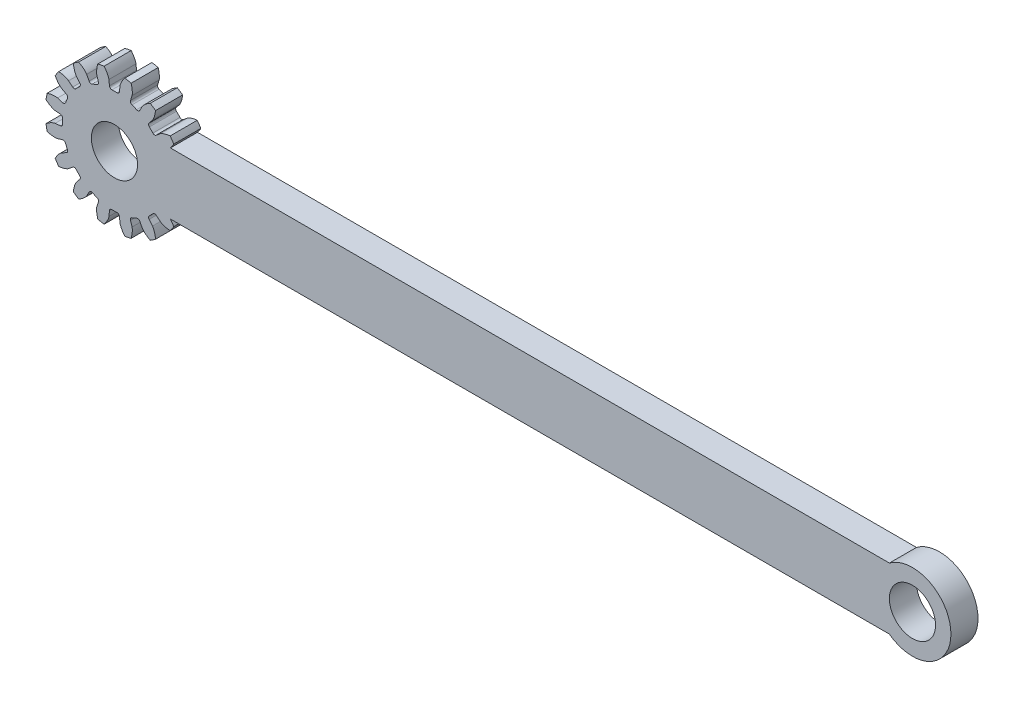
from build123d import *

# Parameters (mm, degrees)
BOSS_EXTRUDE1_DEPTH      = 5.588
CUT_EXTRUDE1_DEPTH       = 174.299858936
FILLET1_R                = 0.496244564
CIRPATTERN1_COUNT        = 16
FILLET1_OF_CIRPATTERN1_R = 0.496244564
SKETCH4_W                = 5.588
SKETCH4_H                = 12.7
BOSS_EXTRUDE2_DEPTH      = 5.08
SKETCH5_R                = 4.7625
CUT_EXTRUDE2_DEPTH       = 174.286693569


with BuildPart() as part:
    # Sketch1 → Boss-Extrude1 (new body)
    with BuildSketch(Plane.XY):
        with BuildLine():
            Line((12.798834175, -6.35), (159.919473719, -6.35))
            ThreePointArc((159.919473719, -6.35), (172.619473719, 0), (159.919473719, 6.35))
            Line((159.919473719, 6.35), (12.798834175, 6.35))
            ThreePointArc((12.798834175, 6.35), (-14.2875, 0), (12.798834175, -6.35))
        make_face()
    extrude(amount=BOSS_EXTRUDE1_DEPTH)

    # Sketch3 → Cut-Extrude1 (cut, through all)
    with BuildSketch(Plane.XY.offset(5.588)):
        with BuildLine():
            Line((10.669686204, 0.991168726), (12.242763286, 1.137300935))
            add(Edge.make_bspline(
                [(12.242763286, 1.137300935), (12.245929967, 1.137635145), (12.254799044, 1.138695353), (12.271514653, 1.141184629), (12.29870614, 1.145934011), (12.333220151, 1.152994888), (12.377662137, 1.163277963), (12.429783965, 1.17687676), (12.486802447, 1.193373916), (12.548533013, 1.212993372), (12.609834217, 1.234041125), (12.670705774, 1.256406144), (12.731081475, 1.279917576), (12.803889967, 1.309849423), (12.890730812, 1.347756353), (12.991516606, 1.39498787), (13.104943259, 1.451996931), (13.219546646, 1.513758469), (13.331477466, 1.577532772), (13.443549225, 1.64539651), (13.551258545, 1.713486182), (13.662026861, 1.787694028), (13.763711865, 1.857965741), (13.876348629, 1.940521828), (13.966876457, 2.008265101), (14.059278441, 2.081414128), (14.10408503, 2.117483013), (14.126913279, 2.136112695)],
                knots=[0, 0, 0, 0, 0, 0.005376749, 0.015083688, 0.02853182, 0.04661014, 0.064854849, 0.092110526, 0.119476176, 0.146842496, 0.174208854, 0.201574956, 0.228941013, 0.256307345, 0.307035032, 0.361767352, 0.416499661, 0.471231937, 0.525964282, 0.580696616, 0.635428982, 0.690161387, 0.744893688, 0.799626082, 0.854358407, 0.909090915, 0.909090915, 0.909090915, 0.909090915, 0.909090915], degree=4))
            ThreePointArc((14.126913279, 2.136112695), (14.2875, 0), (14.126913279, -2.136112695))
            add(Edge.make_bspline(
                [(12.242763286, -1.137300935), (12.245929967, -1.137635145), (12.254799044, -1.138695353), (12.271514653, -1.141184629), (12.29870614, -1.145934011), (12.333220151, -1.152994888), (12.377662137, -1.163277963), (12.429783965, -1.17687676), (12.486802447, -1.193373916), (12.548533013, -1.212993372), (12.609834217, -1.234041125), (12.670705774, -1.256406144), (12.731081475, -1.279917576), (12.803889967, -1.309849423), (12.890730812, -1.347756353), (12.991516606, -1.39498787), (13.104943259, -1.451996931), (13.219546646, -1.513758469), (13.331477466, -1.577532772), (13.443549225, -1.64539651), (13.551258545, -1.713486182), (13.662026861, -1.787694028), (13.763711865, -1.857965741), (13.876348629, -1.940521828), (13.966876457, -2.008265101), (14.059278441, -2.081414128), (14.10408503, -2.117483013), (14.126913279, -2.136112695)],
                knots=[0, 0, 0, 0, 0, 0.005376749, 0.015083688, 0.02853182, 0.04661014, 0.064854849, 0.092110526, 0.119476176, 0.146842496, 0.174208854, 0.201574956, 0.228941013, 0.256307345, 0.307035032, 0.361767352, 0.416499661, 0.471231937, 0.525964282, 0.580696616, 0.635428982, 0.690161387, 0.744893688, 0.799626082, 0.854358407, 0.909090915, 0.909090915, 0.909090915, 0.909090915, 0.909090915], degree=4))
            Line((12.242763286, -1.137300935), (10.669686204, -0.991168726))
            ThreePointArc((10.669686204, -0.991168726), (10.715625, 0), (10.669686204, 0.991168726))
        make_face()
    cut_extrude1 = extrude(amount=-CUT_EXTRUDE1_DEPTH, mode=Mode.SUBTRACT)

    # Fillet1
    fillet1_edges = [part.edges().sort_by_distance(p)[0] for p in [
        (10.669686204, -0.991168726, 2.794),
        (10.669686204, 0.991168726, 2.794),
    ]]
    fillet(fillet1_edges, radius=FILLET1_R)

    # CirPattern1: Cut-Extrude1 ×16 about axis
    cirpattern1_axis = Axis((0, 0, 5.588), (0, 0, 1))
    for i in range(1, CIRPATTERN1_COUNT):
        add(cut_extrude1.rotate(cirpattern1_axis, i * 360 / CIRPATTERN1_COUNT), mode=Mode.SUBTRACT)

    # Fillet1 of CirPattern1
    fillet1_of_cirpattern1_edges = [part.edges().sort_by_distance(p)[0] for p in [
        (10.236808553, 3.167391639, 2.794),
        (9.478200852, 4.998832639, 2.794),
        (8.245469596, 6.84374534, 2.794),
        (6.84374534, 8.245469596, 2.794),
        (4.998832639, 9.478200852, 2.794),
        (3.167391639, 10.236808553, 2.794),
        (0.991168726, 10.669686204, 2.794),
        (-0.991168726, 10.669686204, 2.794),
        (-3.167391639, 10.236808553, 2.794),
        (-4.998832639, 9.478200852, 2.794),
        (-6.84374534, 8.245469596, 2.794),
        (-8.245469596, 6.84374534, 2.794),
        (-9.478200852, 4.998832639, 2.794),
        (-10.236808553, 3.167391639, 2.794),
        (-10.669686204, 0.991168726, 2.794),
        (-10.669686204, -0.991168726, 2.794),
        (-10.236808553, -3.167391639, 2.794),
        (-9.478200852, -4.998832639, 2.794),
        (-8.245469596, -6.84374534, 2.794),
        (-6.84374534, -8.245469596, 2.794),
        (-4.998832639, -9.478200852, 2.794),
        (-3.167391639, -10.236808553, 2.794),
        (-0.991168726, -10.669686204, 2.794),
        (0.991168726, -10.669686204, 2.794),
        (3.167391639, -10.236808553, 2.794),
        (4.998832639, -9.478200852, 2.794),
        (6.84374534, -8.245469596, 2.794),
        (8.245469596, -6.84374534, 2.794),
        (9.478200852, -4.998832639, 2.794),
        (10.236808553, -3.167391639, 2.794),
    ]]
    fillet(fillet1_of_cirpattern1_edges, radius=FILLET1_OF_CIRPATTERN1_R)

    # Sketch4 → Boss-Extrude2 (add, symmetric)
    with BuildSketch(Plane(origin=(10.16, 0, 0), x_dir=(0, 0, -1), z_dir=(1, 0, 0))):
        with Locations((-2.794, 0)):
            Rectangle(SKETCH4_W, SKETCH4_H)
    extrude(amount=BOSS_EXTRUDE2_DEPTH, both=True)

    # Sketch5 → Cut-Extrude2 (cut, through all)
    with BuildSketch(Plane.XY.offset(5.588)):
        Circle(SKETCH5_R)
        with Locations((164.681973719, 0)):
            Circle(SKETCH5_R)
    extrude(amount=-CUT_EXTRUDE2_DEPTH, mode=Mode.SUBTRACT)


solid = part.part
